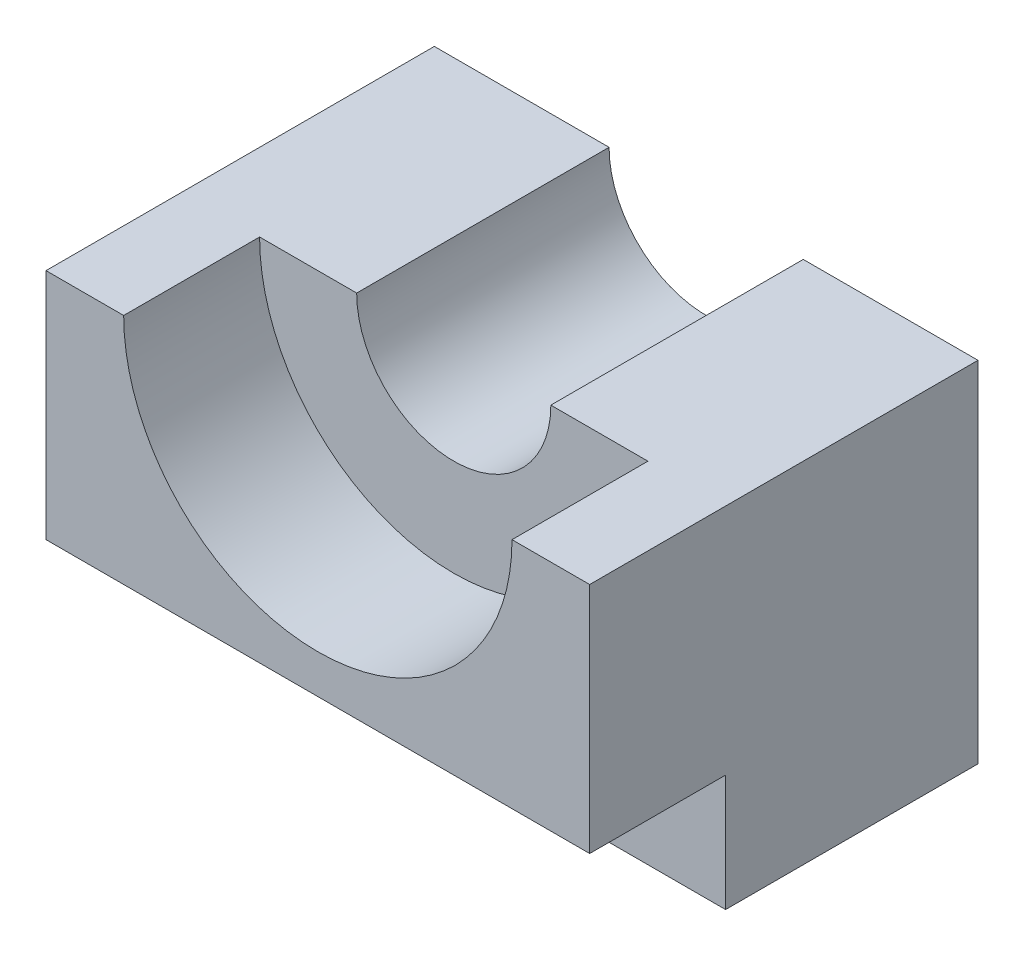
from build123d import *

# Parameters (mm, degrees)
EXTRUDE_3_DEPTH = 13
SKETCH_5_4_W    = 28
SKETCH_5_4_H    = 10.634799235
EXTRUDE_4_DEPTH = 13
EXTRUDE_5_DEPTH = 7


with BuildPart() as part:
    # 草图5 → 凸台-拉伸3 (new body)
    with BuildSketch(Plane.XY):
        with BuildLine():
            Line((14, 9), (5, 9))
            ThreePointArc((5, 9), (0, 4), (-5, 9))
            Line((-5, 9), (-14, 9))
            Line((-14, 9), (-14, 1.634799235))
            Line((-14, 1.634799235), (14, 1.634799235))
            Line((14, 1.634799235), (14, 9))
        make_face()
    extrude(amount=EXTRUDE_3_DEPTH)



with BuildPart() as body_2:
    # 草图5<4> → 凸台-拉伸4 (new body)
    with BuildSketch(Plane.XY):
        with Locations((0, -3.682600382)):
            Rectangle(SKETCH_5_4_W, SKETCH_5_4_H)
    extrude(amount=EXTRUDE_4_DEPTH)


with BuildPart() as part_1:
    add(part.part)

    add(body_2.part)  # 凸台-拉伸5 merges body 2
    # 草图6 → 凸台-拉伸5 (add)
    with BuildSketch(Plane.XY.offset(13)):
        with BuildLine():
            Line((-10, 9), (-14, 9))
            Line((-14, 9), (-14, -3))
            Line((-14, -3), (14, -3))
            Line((14, -3), (14, 9))
            Line((14, 9), (10, 9))
            ThreePointArc((10, 9), (0, -1), (-10, 9))
        make_face()
    extrude(amount=EXTRUDE_5_DEPTH)


solid = part_1.part
